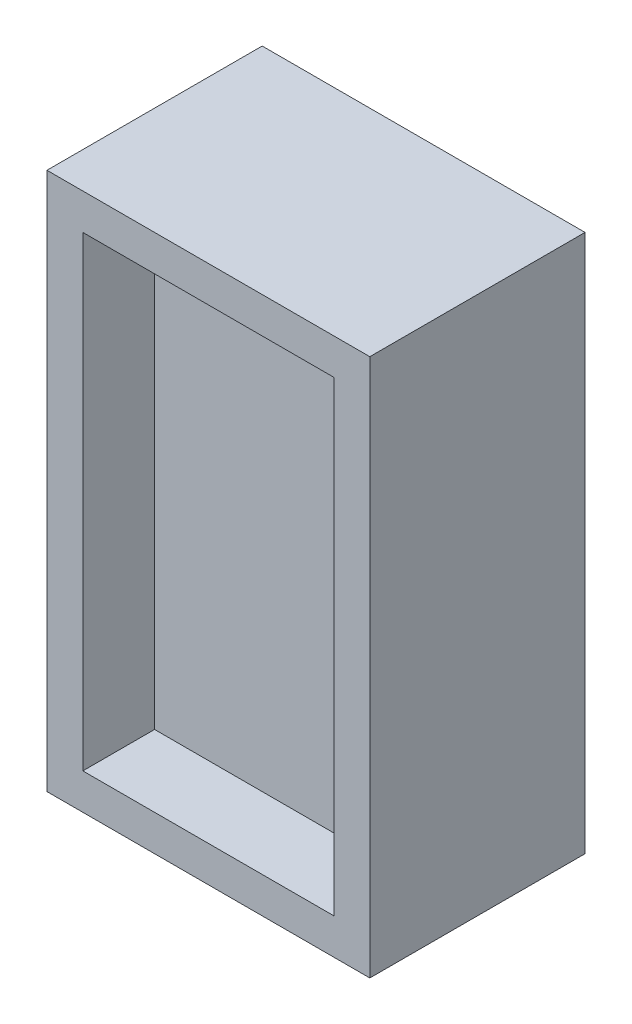
from build123d import *

# Parameters (mm, degrees)
SKETCH1_W           = 57.15
SKETCH1_H           = 95.25
BOSS_EXTRUDE1_DEPTH = 38.1
SKETCH2_W           = 44.45
SKETCH2_H           = 82.55
CUT_EXTRUDE1_DEPTH  = 12.7


with BuildPart() as part:
    # Sketch1 → Boss-Extrude1 (new body)
    with BuildSketch(Plane.XY):
        with Locations((28.575, -47.625)):
            Rectangle(SKETCH1_W, SKETCH1_H)
    extrude(amount=BOSS_EXTRUDE1_DEPTH)

    # Sketch2 → Cut-Extrude1 (cut)
    with BuildSketch(Plane.XY.offset(38.1)):
        with Locations((28.575, -47.625)):
            Rectangle(SKETCH2_W, SKETCH2_H)
    extrude(amount=-CUT_EXTRUDE1_DEPTH, mode=Mode.SUBTRACT)


solid = part.part
